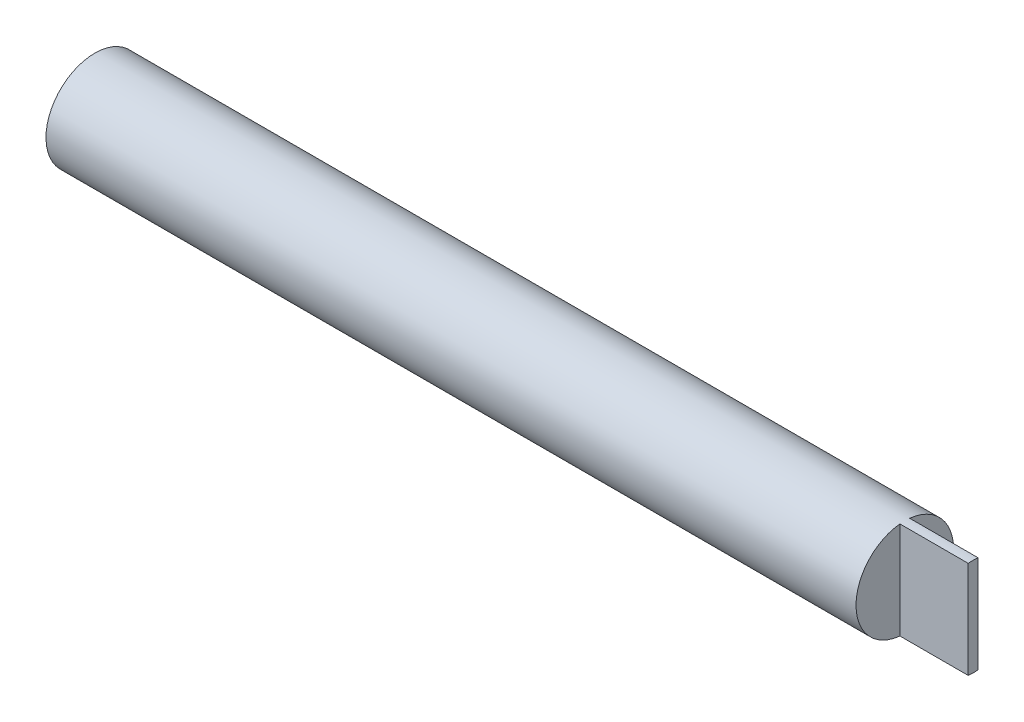
from build123d import *

# Parameters (mm, degrees)
SKETCH1_R     = 5
CORPO_DEPTH   = 90
ABA_START     = -7
ABA_1MM_DEPTH = 7


with BuildPart() as part:
    # Sketch1 → Corpo (new body)
    with BuildSketch(Plane(origin=(0, 0, 0), x_dir=(0, 0, -1), z_dir=(1, 0, 0))):
        with Locations(Location((0, 0, 0), (0, 0, 180))):
            Circle(SKETCH1_R)
    extrude(amount=CORPO_DEPTH)

    # Sketch2 → Aba 1mm (cut)
    with BuildSketch(Plane(origin=(90, 0, 0), x_dir=(0, 0, -1), z_dir=(1, 0, 0)).offset(ABA_START)):
        with BuildLine():
            ThreePointArc((-0.5, 4.974937186), (-5, 0), (-0.5, -4.974937186))
            Line((-0.5, -4.974937186), (-0.5, 4.974937186))
        make_face()
        with BuildLine():
            Line((0.5, 4.974937186), (0.5, -4.974937186))
            ThreePointArc((0.5, -4.974937186), (3.708099244, -3.354101966), (5, 0))
            ThreePointArc((5, 0), (3.708099244, 3.354101966), (0.5, 4.974937186))
        make_face()
    extrude(amount=ABA_1MM_DEPTH, mode=Mode.SUBTRACT)


solid = part.part
